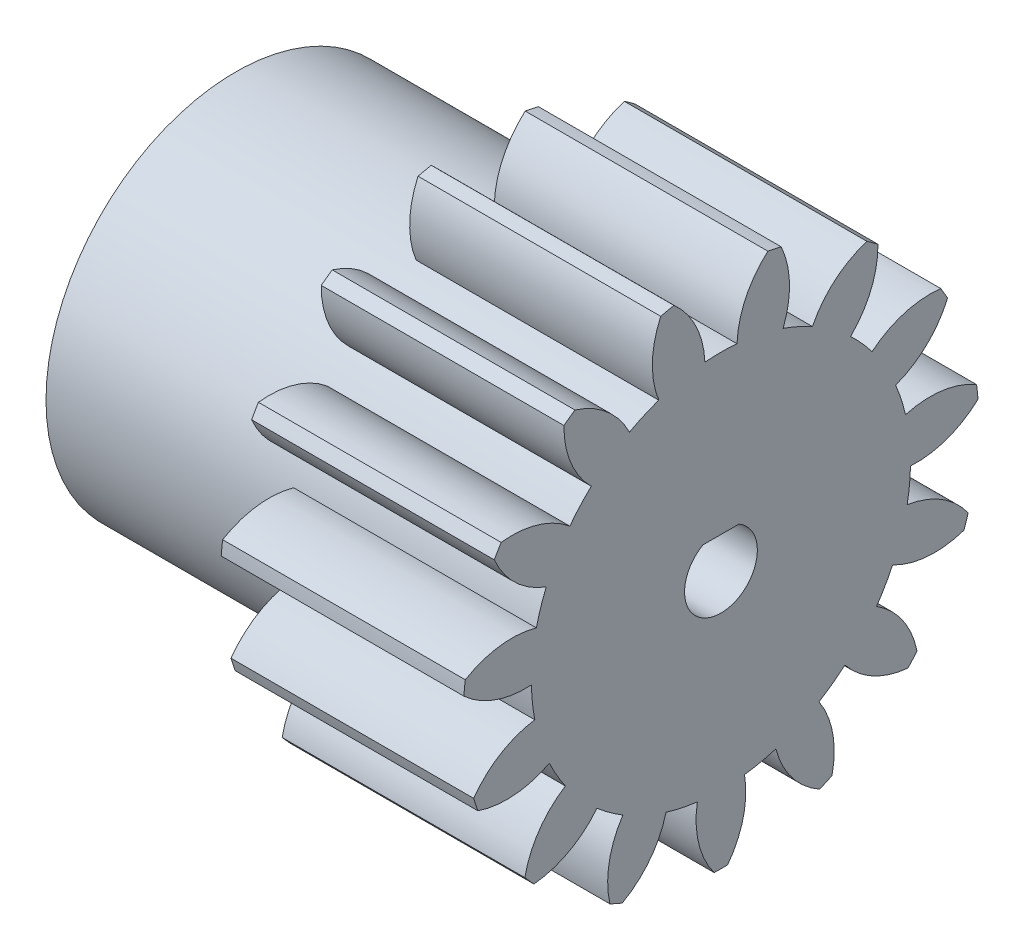
from build123d import *
from build123d.topology import SkipClean

# Parameters (mm, degrees)
BASPROSKE_W         = 10
BASPROSKE_H         = 10.625
TOOTHCUT_DEPTH      = 19.049411348
TEETHCUTS_COUNT     = 15
TEETHCUTS_ANGLE     = 336
BORSKE_R            = 1.5
BORE_DEPTH          = 50.0000508
BOSS_EXTRUDE1_START = 10
SKETCH1_R           = 7.8115
SKETCH1_R_2         = 1.5
BOSS_EXTRUDE1_DEPTH = 10
BOSS_EXTRUDE2_DEPTH = 20


with BuildPart() as part:
    # BasProSke → Base-Revolve (revolve)
    with BuildSketch(Plane(origin=(0, 0, 0), x_dir=(1, 0, 0), z_dir=(0, 1, 0)), mode=Mode.PRIVATE) as base_revolve_sk:
        with Locations((5, 5.3125)):
            Rectangle(BASPROSKE_W, BASPROSKE_H)
    revolve(base_revolve_sk.sketch.rotate(Axis((-10, 0, 0), (1, 0, 0)), 180), axis=Axis((-10, 0, 0), (1, 0, 0)))

    # TooCutSke → ToothCut (cut, through all)
    with BuildSketch(Plane(origin=(0, 0, 0), x_dir=(0, 0, -1), z_dir=(1, 0, 0))):
        with BuildLine():
            ThreePointArc((0.660831632, 7.78349753), (0, 7.8115), (-0.660831632, 7.78349753))
            ThreePointArc((-0.660831632, 7.78349753), (-1.031814994, 9.260718016), (-1.959681305, 10.46855622))
            ThreePointArc((-1.959681305, 10.46855622), (0, 10.6504), (1.959681305, 10.46855622))
            ThreePointArc((1.959681305, 10.46855622), (1.031814994, 9.260718016), (0.660831632, 7.78349753))
        make_face()
    toothcut = extrude(amount=TOOTHCUT_DEPTH, mode=Mode.SUBTRACT)

    # TeethCuts: ToothCut ×15 about axis
    teethcuts_axis = Axis((-10, 0, 0), (1, 0, 0))
    for i in range(1, TEETHCUTS_COUNT):
        add(toothcut.rotate(teethcuts_axis, i * TEETHCUTS_ANGLE / (TEETHCUTS_COUNT - 1)), mode=Mode.SUBTRACT)

    # BorSke → Bore (cut, symmetric)
    with BuildSketch(Plane(origin=(0, 0, 0), x_dir=(0, 0, -1), z_dir=(1, 0, 0))):
        with Locations(Location((0, 0, 0), (0, 0, 180))):
            Circle(BORSKE_R)
    extrude(amount=BORE_DEPTH, both=True, mode=Mode.SUBTRACT)

    # Sketch1 → Boss-Extrude1 (add)
    with SkipClean():  # the faces are left unmerged after this step: merging them gives an invalid solid
        with BuildSketch(Plane.ZY.offset(BOSS_EXTRUDE1_START)):
            Circle(SKETCH1_R)
            Circle(SKETCH1_R_2, mode=Mode.SUBTRACT)
        extrude(amount=-BOSS_EXTRUDE1_DEPTH)

    # Sketch2 → Boss-Extrude2 (add)
    with SkipClean():  # the faces are left unmerged after this step: merging them gives an invalid solid
        with BuildSketch(Plane(origin=(10, 0, 0), x_dir=(0, 0, -1), z_dir=(1, 0, 0))):
            with BuildLine():
                ThreePointArc((0.739577582, 1.305), (0, 1.5), (-0.739577582, 1.305))
                Line((-0.739577582, 1.305), (0.739577582, 1.305))
            make_face()
        extrude(amount=-BOSS_EXTRUDE2_DEPTH)


solid = part.part
